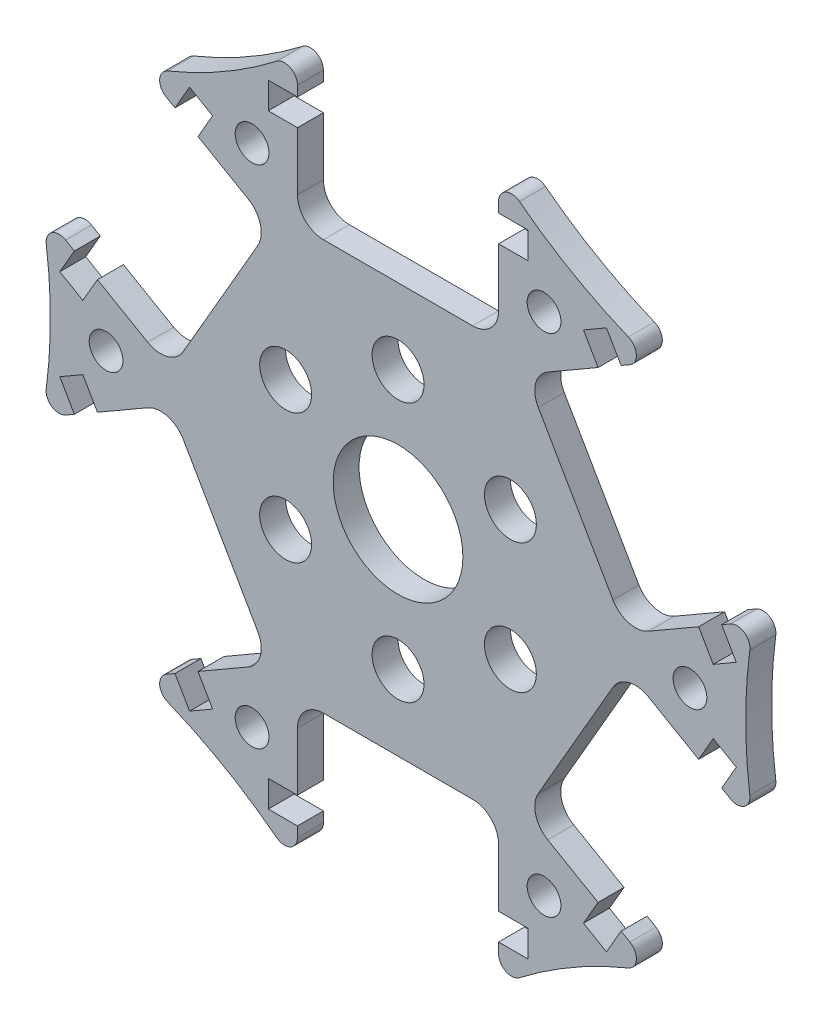
from build123d import *

# Parameters (mm, degrees)
SKETCH_1_R          = 28.3
EXTRUDE_1_DEPTH     = 2
SKETCH_2_R          = 5
SKETCH_2_R_2        = 2
SKETCH_2_R_3        = 1.3
CUT_EXTRUDE_1_DEPTH = 41.072184867
CUT_EXTRUDE_3_DEPTH = 40.315613947
FILLET_2_R          = 2
FILLET_1_R          = 1


with BuildPart() as part:
    # ｽｹｯﾁ1 → ﾎﾞｽ - 押し出し1 (new body)
    with BuildSketch(Plane.XY):
        Circle(SKETCH_1_R)
    extrude(amount=EXTRUDE_1_DEPTH)

    # ｽｹｯﾁ2 → ｶｯﾄ - 押し出し1 (cut, through all)
    with BuildSketch(Plane.XY.offset(2)):
        Circle(SKETCH_2_R)
        with Locations((8.660254038, 5)):
            Circle(SKETCH_2_R_2)
        with Locations((8.660254038, -5)):
            Circle(SKETCH_2_R_2)
        with Locations((0, -10)):
            Circle(SKETCH_2_R_2)
        with Locations((-8.660254038, -5)):
            Circle(SKETCH_2_R_2)
        with Locations((-8.660254038, 5)):
            Circle(SKETCH_2_R_2)
        with Locations((0, 10)):
            Circle(SKETCH_2_R_2)
        with Locations((11.25, 19.485571585)):
            Circle(SKETCH_2_R_3)
        with Locations((22.5, 0)):
            Circle(SKETCH_2_R_3)
        with Locations((11.25, -19.485571585)):
            Circle(SKETCH_2_R_3)
        with Locations((-11.25, -19.485571585)):
            Circle(SKETCH_2_R_3)
        with Locations((-22.5, 0)):
            Circle(SKETCH_2_R_3)
        with Locations((-11.25, 19.485571585)):
            Circle(SKETCH_2_R_3)
        with BuildLine():
            Line((7.75, 24.325), (10, 24.325))
            Line((10, 24.325), (10, 22.275))
            Line((10, 22.275), (7.75, 22.275))
            Line((7.75, 22.275), (7.75, 15.8))
            Line((7.75, 15.8), (-7.75, 15.8))
            Line((-7.75, 15.8), (-7.75, 22.275))
            Line((-7.75, 22.275), (-10, 22.275))
            Line((-10, 22.275), (-10, 24.325))
            Line((-10, 24.325), (-7.75, 24.325))
            Line((-7.75, 24.325), (-7.75, 27.21814652))
            ThreePointArc((-7.75, 27.21814652), (0, 28.3), (7.75, 27.21814652))
            Line((7.75, 27.21814652), (7.75, 24.325))
        make_face()
        with BuildLine():
            Line((24.941067947, 5.450803121), (26.066067947, 3.502245962))
            Line((26.066067947, 3.502245962), (24.290715869, 2.477245962))
            Line((24.290715869, 2.477245962), (23.165715869, 4.425803121))
            Line((23.165715869, 4.425803121), (17.55820138, 1.188303121))
            Line((17.55820138, 1.188303121), (9.80820138, 14.611696879))
            Line((9.80820138, 14.611696879), (15.415715869, 17.849196879))
            Line((15.415715869, 17.849196879), (14.290715869, 19.797754038))
            Line((14.290715869, 19.797754038), (16.066067947, 20.822754038))
            Line((16.066067947, 20.822754038), (17.191067947, 18.874196879))
            Line((17.191067947, 18.874196879), (19.69660633, 20.320770139))
            ThreePointArc((19.69660633, 20.320770139), (24.508518927, 14.15), (27.44660633, 6.897376381))
            Line((27.44660633, 6.897376381), (24.941067947, 5.450803121))
        make_face()
        with BuildLine():
            Line((17.191067947, -18.874196879), (16.066067947, -20.822754038))
            Line((16.066067947, -20.822754038), (14.290715869, -19.797754038))
            Line((14.290715869, -19.797754038), (15.415715869, -17.849196879))
            Line((15.415715869, -17.849196879), (9.80820138, -14.611696879))
            Line((9.80820138, -14.611696879), (17.55820138, -1.188303121))
            Line((17.55820138, -1.188303121), (23.165715869, -4.425803121))
            Line((23.165715869, -4.425803121), (24.290715869, -2.477245962))
            Line((24.290715869, -2.477245962), (26.066067947, -3.502245962))
            Line((26.066067947, -3.502245962), (24.941067947, -5.450803121))
            Line((24.941067947, -5.450803121), (27.44660633, -6.897376381))
            ThreePointArc((27.44660633, -6.897376381), (24.508518927, -14.15), (19.69660633, -20.320770139))
            Line((19.69660633, -20.320770139), (17.191067947, -18.874196879))
        make_face()
        with BuildLine():
            Line((-7.75, -24.325), (-10, -24.325))
            Line((-10, -24.325), (-10, -22.275))
            Line((-10, -22.275), (-7.75, -22.275))
            Line((-7.75, -22.275), (-7.75, -15.8))
            Line((-7.75, -15.8), (7.75, -15.8))
            Line((7.75, -15.8), (7.75, -22.275))
            Line((7.75, -22.275), (10, -22.275))
            Line((10, -22.275), (10, -24.325))
            Line((10, -24.325), (7.75, -24.325))
            Line((7.75, -24.325), (7.75, -27.21814652))
            ThreePointArc((7.75, -27.21814652), (0, -28.3), (-7.75, -27.21814652))
            Line((-7.75, -27.21814652), (-7.75, -24.325))
        make_face()
        with BuildLine():
            Line((-24.941067947, -5.450803121), (-26.066067947, -3.502245962))
            Line((-26.066067947, -3.502245962), (-24.290715869, -2.477245962))
            Line((-24.290715869, -2.477245962), (-23.165715869, -4.425803121))
            Line((-23.165715869, -4.425803121), (-17.55820138, -1.188303121))
            Line((-17.55820138, -1.188303121), (-9.80820138, -14.611696879))
            Line((-9.80820138, -14.611696879), (-15.415715869, -17.849196879))
            Line((-15.415715869, -17.849196879), (-14.290715869, -19.797754038))
            Line((-14.290715869, -19.797754038), (-16.066067947, -20.822754038))
            Line((-16.066067947, -20.822754038), (-17.191067947, -18.874196879))
            Line((-17.191067947, -18.874196879), (-19.69660633, -20.320770139))
            ThreePointArc((-19.69660633, -20.320770139), (-24.508518927, -14.15), (-27.44660633, -6.897376381))
            Line((-27.44660633, -6.897376381), (-24.941067947, -5.450803121))
        make_face()
        with BuildLine():
            Line((-17.191067947, 18.874196879), (-16.066067947, 20.822754038))
            Line((-16.066067947, 20.822754038), (-14.290715869, 19.797754038))
            Line((-14.290715869, 19.797754038), (-15.415715869, 17.849196879))
            Line((-15.415715869, 17.849196879), (-9.80820138, 14.611696879))
            Line((-9.80820138, 14.611696879), (-17.55820138, 1.188303121))
            Line((-17.55820138, 1.188303121), (-23.165715869, 4.425803121))
            Line((-23.165715869, 4.425803121), (-24.290715869, 2.477245962))
            Line((-24.290715869, 2.477245962), (-26.066067947, 3.502245962))
            Line((-26.066067947, 3.502245962), (-24.941067947, 5.450803121))
            Line((-24.941067947, 5.450803121), (-27.44660633, 6.897376381))
            ThreePointArc((-27.44660633, 6.897376381), (-24.508518927, 14.15), (-19.69660633, 20.320770139))
            Line((-19.69660633, 20.320770139), (-17.191067947, 18.874196879))
        make_face()
    extrude(amount=-CUT_EXTRUDE_1_DEPTH, mode=Mode.SUBTRACT)

    # ｽｹｯﾁ3 → ｶｯﾄ - 押し出し3 (cut, through all)
    with BuildSketch(Plane.XY.offset(2)):
        with BuildLine():
            ThreePointArc((7.75, 27.21814652), (13.394592318, 23.200114441), (19.69660633, 20.320770139))
            ThreePointArc((19.69660633, 20.320770139), (14.15, 24.508518927), (7.75, 27.21814652))
        make_face()
        with BuildLine():
            ThreePointArc((27.44660633, 6.897376381), (26.789184636, 0), (27.44660633, -6.897376381))
            ThreePointArc((27.44660633, -6.897376381), (28.3, 0), (27.44660633, 6.897376381))
        make_face()
        with BuildLine():
            ThreePointArc((19.69660633, -20.320770139), (13.394592318, -23.200114441), (7.75, -27.21814652))
            ThreePointArc((7.75, -27.21814652), (14.15, -24.508518927), (19.69660633, -20.320770139))
        make_face()
        with BuildLine():
            ThreePointArc((-7.75, -27.21814652), (-13.394592318, -23.200114441), (-19.69660633, -20.320770139))
            ThreePointArc((-19.69660633, -20.320770139), (-14.15, -24.508518927), (-7.75, -27.21814652))
        make_face()
        with BuildLine():
            ThreePointArc((-27.44660633, -6.897376381), (-26.789184636, 0), (-27.44660633, 6.897376381))
            ThreePointArc((-27.44660633, 6.897376381), (-28.3, 0), (-27.44660633, -6.897376381))
        make_face()
        with BuildLine():
            ThreePointArc((-19.69660633, 20.320770139), (-13.394592318, 23.200114441), (-7.75, 27.21814652))
            ThreePointArc((-7.75, 27.21814652), (-14.15, 24.508518927), (-19.69660633, 20.320770139))
        make_face()
    extrude(amount=-CUT_EXTRUDE_3_DEPTH, mode=Mode.SUBTRACT)

    # ﾌｨﾚｯﾄ2
    fillet_2_edges = [part.edges().sort_by_distance(p)[0] for p in [
        (9.80820138, -14.611696879, 1),
        (17.55820138, -1.188303121, 1),
        (17.55820138, 1.188303121, 1),
        (9.80820138, 14.611696879, 1),
        (7.75, 15.8, 1),
        (-7.75, 15.8, 1),
        (-9.80820138, 14.611696879, 1),
        (-17.55820138, 1.188303121, 1),
        (-7.75, -15.8, 1),
        (7.75, -15.8, 1),
        (-17.55820138, -1.188303121, 1),
        (-9.80820138, -14.611696879, 1),
    ]]
    fillet(fillet_2_edges, radius=FILLET_2_R)

    # ﾌｨﾚｯﾄ1
    fillet_1_edges = [part.edges().sort_by_distance(p)[0] for p in [
        (27.44660633, -6.897376381, 1),
        (19.69660633, -20.320770139, 1),
        (19.69660633, 20.320770139, 1),
        (27.44660633, 6.897376381, 1),
        (-7.75, 27.21814652, 1),
        (7.75, 27.21814652, 1),
        (-27.44660633, 6.897376381, 1),
        (-19.69660633, 20.320770139, 1),
        (7.75, -27.21814652, 1),
        (-7.75, -27.21814652, 1),
        (-19.69660633, -20.320770139, 1),
        (-27.44660633, -6.897376381, 1),
    ]]
    fillet(fillet_1_edges, radius=FILLET_1_R)


solid = part.part
